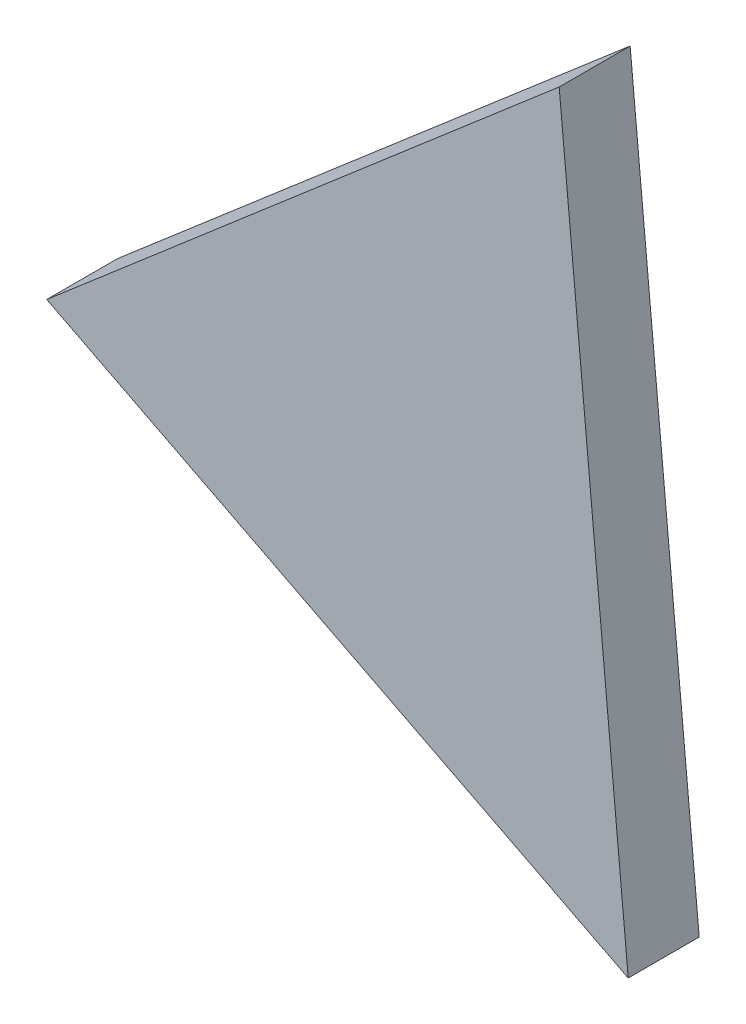
from build123d import *

# Parameters (mm, degrees)
BOSS_EXTRUDE1_DEPTH = 30


with BuildPart() as part:
    # Sketch1 → Boss-Extrude1 (new body)
    with BuildSketch(Plane.XY):
        Polygon((78.419715643, -149.771287902), (49.229463405, 161.732960197), (-167.303978224, -24.299575135), align=None)
    extrude(amount=-BOSS_EXTRUDE1_DEPTH)


solid = part.part
